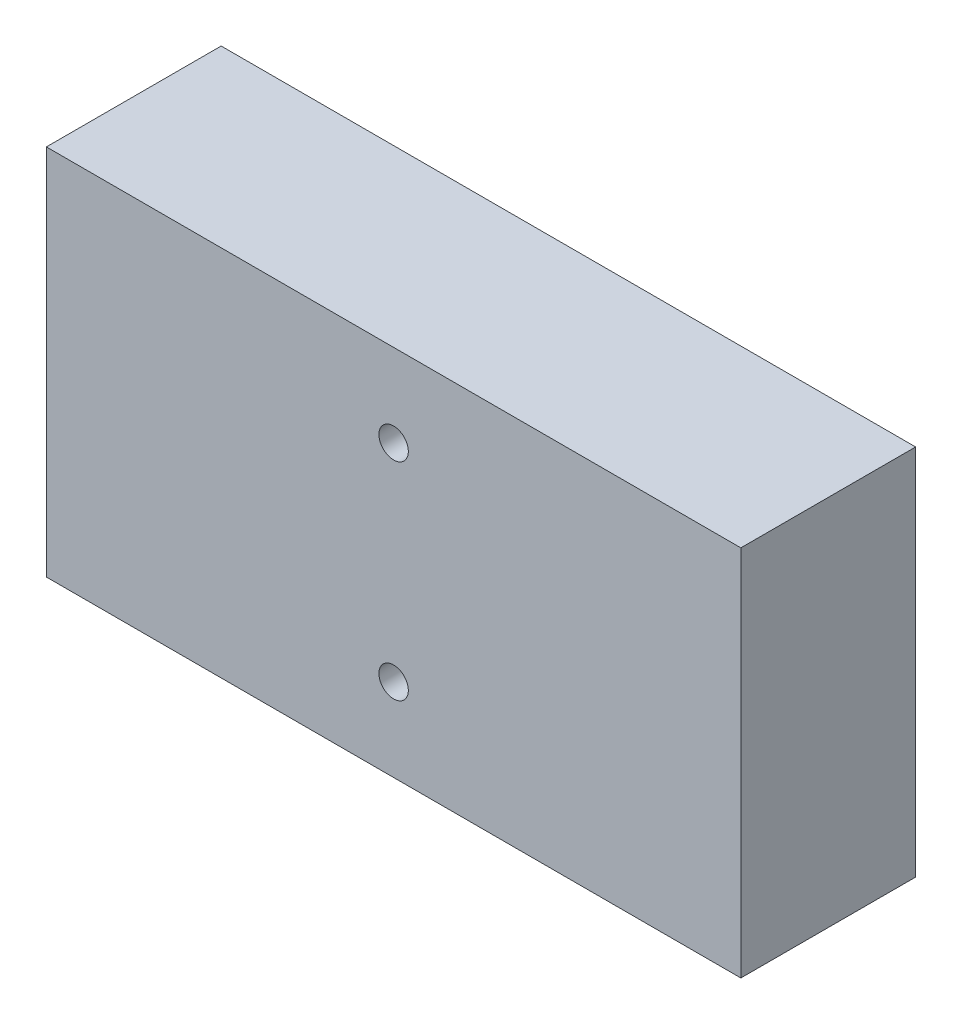
from build123d import *

# Parameters (mm, degrees)
SKETCH1_W           = 75.5
SKETCH1_H           = 40.5
SKETCH1_R           = 1.6
BOSS_EXTRUDE1_DEPTH = 19


with BuildPart() as part:
    # Sketch1 → Boss-Extrude1 (new body)
    with BuildSketch(Plane.XY):
        Rectangle(SKETCH1_W, SKETCH1_H)
        with Locations((0, 11.25)):
            Circle(SKETCH1_R, mode=Mode.SUBTRACT)
        with Locations(Location((0, -11.25, 0), (0, 0, 180))):
            Circle(SKETCH1_R, mode=Mode.SUBTRACT)
    extrude(amount=BOSS_EXTRUDE1_DEPTH)


solid = part.part
